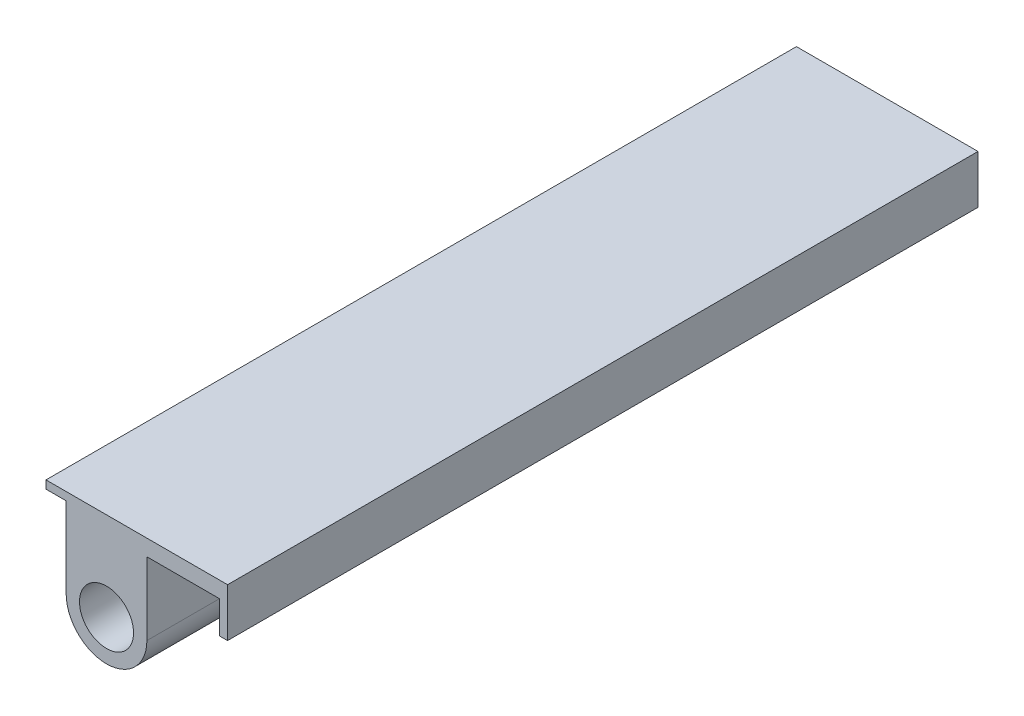
from build123d import *

# Parameters (mm, degrees)
SKETCH_1_R      = 3.35
EXTRUDE_1_DEPTH = 93


with BuildPart() as part:
    # Эскиз1 → Бобышка-Вытянуть1 (new body)
    with BuildSketch(Plane.XY.offset(93)):
        with BuildLine():
            Line((-2.5, 0), (0, 0))
            Line((0, 0), (0, -10))
            ThreePointArc((0, -10), (5, -15), (10, -10))
            Line((10, -10), (10, -1))
            Line((10, -1), (19, -1))
            Line((19, -1), (19, -5))
            Line((19, -5), (20, -5))
            Line((20, -5), (20, 1))
            Line((20, 1), (-2.5, 1))
            Line((-2.5, 1), (-2.5, 0))
        make_face()
        with Locations((5, -10)):
            Circle(SKETCH_1_R, mode=Mode.SUBTRACT)
    extrude(amount=-EXTRUDE_1_DEPTH)


solid = part.part
